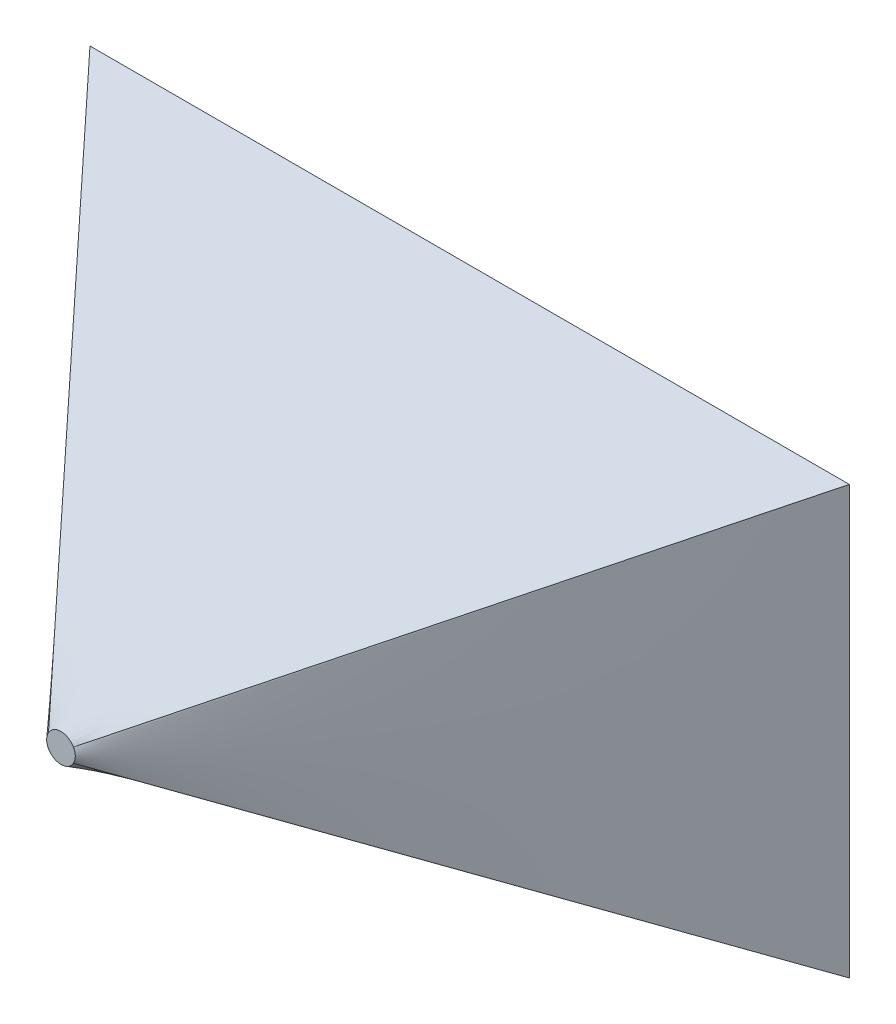
from build123d import *


with BuildPart() as part:
    # Croquis2 for Recubrir2 → Recubrir2 section 0
    with BuildSketch(Plane.XY.offset(200)):
        with BuildLine():
            # circular arc as an exact rational Bezier (weights 1, cos(half-angle), 1)
            Bezier((-6.0998009, 3.434010625), (0, 14.269029818), (6.0998009, 3.434010625), weights=[1, 0.490572946, 1])
            Bezier((6.0998009, 3.434010625), (8.033049079, 0), (6.0998009, -3.434010625), weights=[1, 0.871400128, 1])
            Bezier((6.0998009, -3.434010625), (0, -14.269029818), (-6.0998009, -3.434010625), weights=[1, 0.490572946, 1])
            Bezier((-6.0998009, -3.434010625), (-8.033049079, 0), (-6.0998009, 3.434010625), weights=[1, 0.871400128, 1])
        make_face()
    # Croquis1 → Recubrir2 section 1
    with BuildSketch(Plane.XY):
        with BuildLine():
            Line((-185.8, 104.6), (185.8, 104.6))
            Line((185.8, 104.6), (185.8, -104.6))
            Line((185.8, -104.6), (-185.8, -104.6))
            Line((-185.8, -104.6), (-185.8, 104.6))
        make_face()
    loft()


solid = part.part
